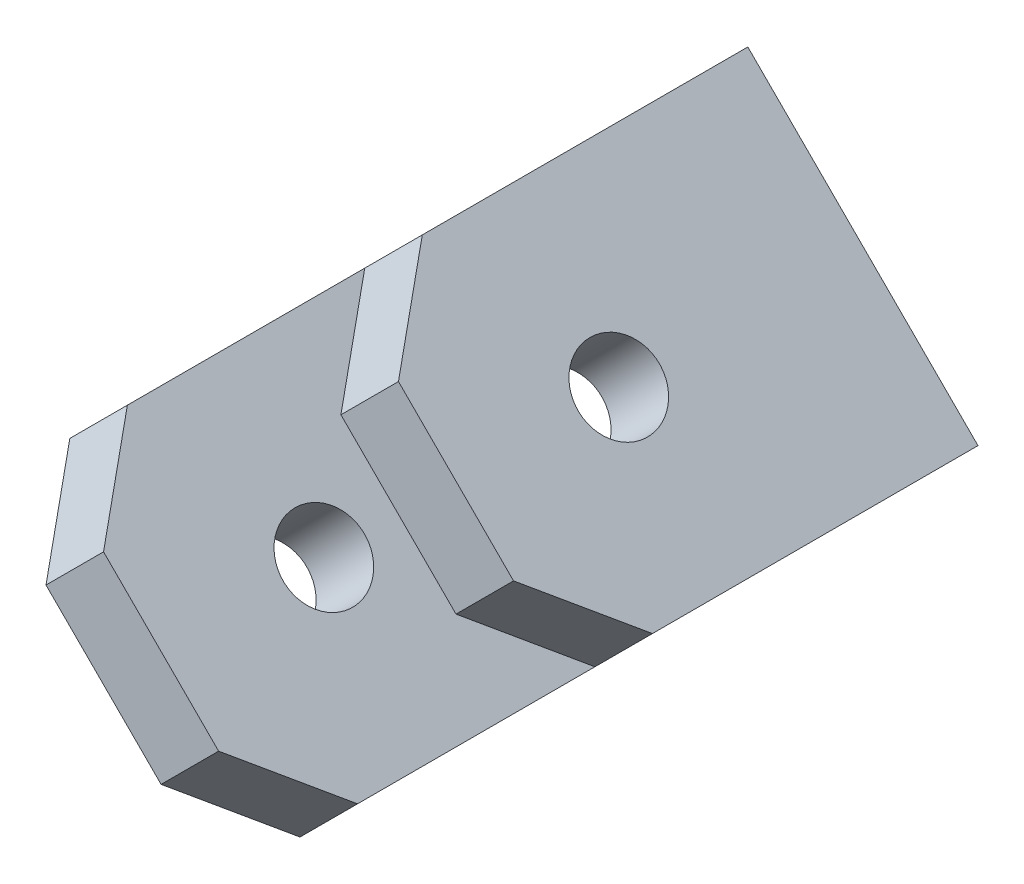
from build123d import *

# Parameters (mm, degrees)
EXTRUDE1_DEPTH     = 127
EXTRUDE1_2_DEPTH   = 127
SKETCH3_R          = 12.7
CUT_EXTRUDE1_DEPTH = 243.321358169


with BuildPart() as part:
    # Sketch1 → Extrude1 (new body)
    with BuildSketch(Plane.XY):
        Polygon((-72.964580984, -1.122532015), (-1.122532015, -72.964580984), (-19.083044257, -90.925093226), (-90.925093226, -19.083044257), align=None)
    extrude(amount=EXTRUDE1_DEPTH)


with BuildPart() as body_2:
    # Sketch1 → Extrude1 2 (new body)
    with BuildSketch(Plane.XY):
        Polygon((1.122532015, 72.964580984), (72.964580984, 1.122532015), (90.925093226, 19.083044257), (19.083044257, 90.925093226), align=None)
    extrude(amount=EXTRUDE1_2_DEPTH)


with BuildPart() as cut_extrude1_tool:
    # Sketch3 → Cut-Extrude1 (new, through all)
    with BuildSketch(Plane(origin=(55.004068742, 55.004068742, 0), x_dir=(0, 0, -1), z_dir=(0.7071067811865511, 0.7071067811865439, 0))):
        with Locations(Location((-76.2, 0, 0), (0, 0, 90))):
            Circle(SKETCH3_R)
        Polygon((-127, -25.4), (-101.6, -50.8), (-127, -50.8), align=None)
        Polygon((-127, 25.4), (-101.6, 50.8), (-127, 50.8), align=None)
    extrude(amount=-CUT_EXTRUDE1_DEPTH)


with BuildPart() as part_1:
    add(part.part)

    # Cut-Extrude1: cut by cut_extrude1_tool
    add(cut_extrude1_tool.part, mode=Mode.SUBTRACT)


with BuildPart() as body_2_1:
    add(body_2.part)

    # Cut-Extrude1: cut by cut_extrude1_tool
    add(cut_extrude1_tool.part, mode=Mode.SUBTRACT)


solid = Compound([part_1.part, body_2_1.part])
